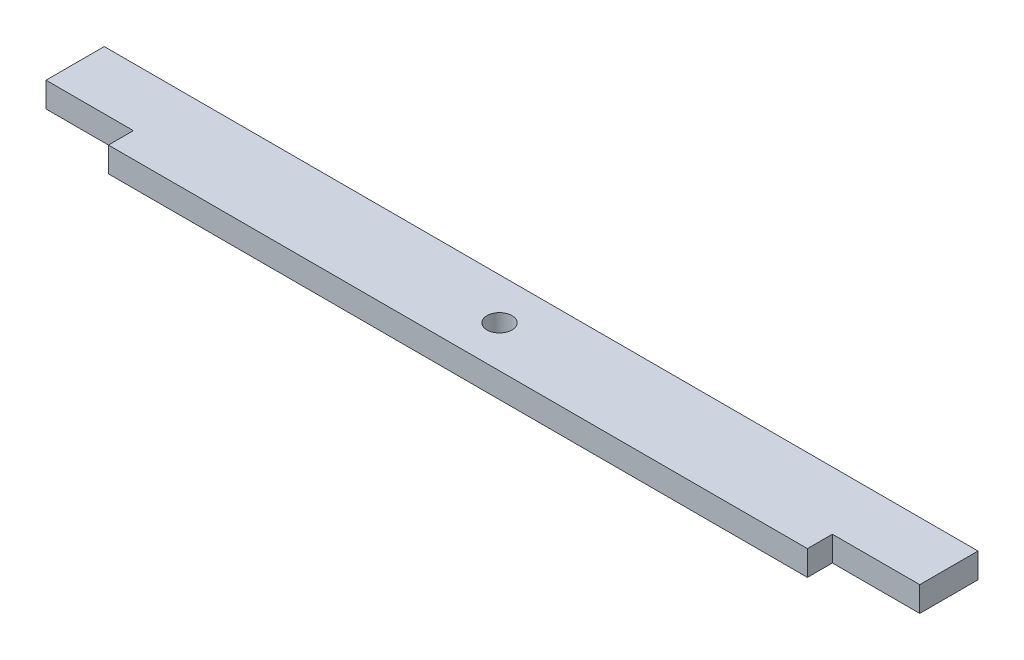
from build123d import *

# Parameters (mm, degrees)
SKETCH1_W           = 105
SKETCH1_H           = 10
SKETCH1_R           = 1.5
BOSS_EXTRUDE1_DEPTH = 3
SKETCH2_W           = 10.5
SKETCH2_H           = 3
CUT_EXTRUDE1_DEPTH  = 53.82281704


with BuildPart() as part:
    # Sketch1 → Boss-Extrude1 (new body)
    with BuildSketch(Plane(origin=(0, 0, 0), x_dir=(1, 0, 0), z_dir=(0, 1, 0))):
        Rectangle(SKETCH1_W, SKETCH1_H)
        with Locations(Location((0, 0, 0), (0, 0, 270))):
            Circle(SKETCH1_R, mode=Mode.SUBTRACT)
    extrude(amount=BOSS_EXTRUDE1_DEPTH)

    # Sketch2 → Cut-Extrude1 (cut, through all)
    with BuildSketch(Plane(origin=(0, 3, 0), x_dir=(1, 0, 0), z_dir=(0, 1, 0))):
        with Locations((-47.25, -3.5)):
            Rectangle(SKETCH2_W, SKETCH2_H)
    cut_extrude1 = extrude(amount=-CUT_EXTRUDE1_DEPTH, mode=Mode.SUBTRACT)

    # Mirror2: Cut-Extrude1 across plane
    add(cut_extrude1.mirror(Plane(origin=(0, 0, 0), x_dir=(0, 0, 1), z_dir=(1, 0, 0))), mode=Mode.SUBTRACT)


solid = part.part
